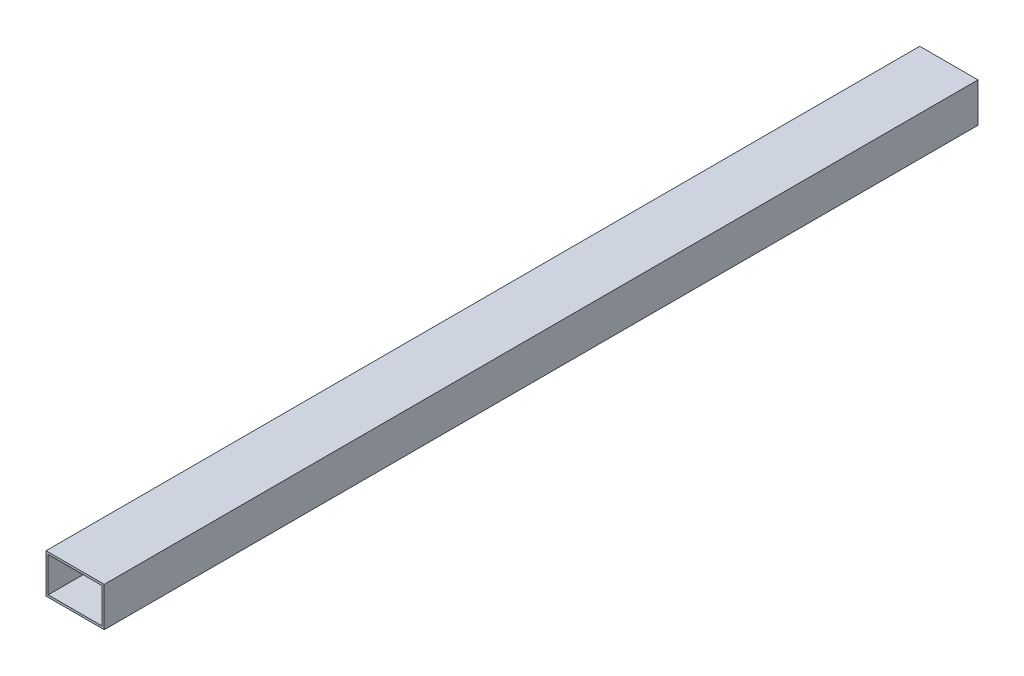
from build123d import *

# Parameters (mm, degrees)
ESQUISSE1_W        = 40
ESQUISSE1_H        = 27
ESQUISSE1_W_2      = 37
ESQUISSE1_H_2      = 24
BOSS_EXTRU_1_DEPTH = 600


with BuildPart() as part:
    # Esquisse1 → Boss.-Extru.1 (new body)
    with BuildSketch(Plane.XY):
        with Locations((20, 13.5)):
            Rectangle(ESQUISSE1_W, ESQUISSE1_H)
        with Locations((20, 13.5)):
            Rectangle(ESQUISSE1_W_2, ESQUISSE1_H_2, mode=Mode.SUBTRACT)
    extrude(amount=BOSS_EXTRU_1_DEPTH)


solid = part.part
